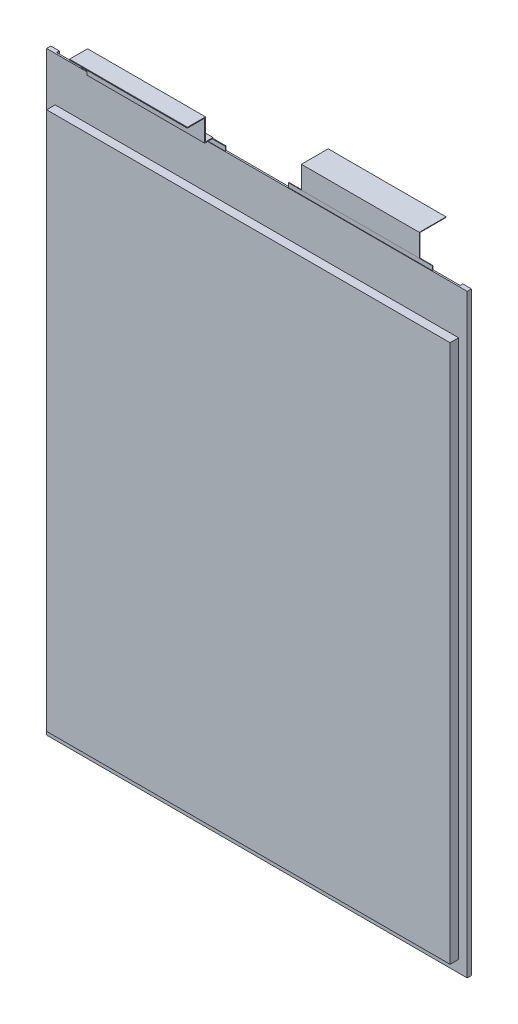
from build123d import *

# Parameters (mm, degrees)
INSULATION_DEPTH             = 0.3
INSULATION_DEPTH_BACK        = 0.3
SKETCH1_W                    = 160.6
SKETCH1_H                    = 227
MAIN_BODY_DEPTH              = 3.55
MAIN_BODY_DEPTH_BACK         = 3.55
SKETCH2_W                    = 154
SKETCH2_H                    = 205.5
SIDE_FOLDS_DEPTH             = 1.016
NEGATIVE_TAB_BASE_DEPTH      = 0.1
NEGATIVE_TAB_BASE_DEPTH_BACK = 0.1
SKETCH6_W                    = 55
SKETCH6_H                    = 18.6
POSITIVE_TAB_BASE_DEPTH      = 0.15
POSITIVE_TAB_BASE_DEPTH_BACK = 0.15
SKETCH7_W                    = 55
SKETCH7_H                    = 18.6
SKETCH110_W                  = 0.3
SKETCH110_H                  = 45
POSITIVE_TAB_DEPTH           = 23.650499994
SKETCH110_ON_SEGMENT_2_W     = 0.3
SKETCH110_ON_SEGMENT_2_H     = 45
POSITIVE_TAB_2_DEPTH         = 49.874449989
SKETCH110_ON_SEGMENT_3_W     = 0.3
SKETCH110_ON_SEGMENT_3_H     = 45
POSITIVE_TAB_3_DEPTH         = 55.260999989
SKETCH110_ON_SEGMENT_4_W     = 0.3
SKETCH110_ON_SEGMENT_4_H     = 45
POSITIVE_TAB_4_DEPTH         = 31.133774994
SKETCH110_ON_SEGMENT_5_W     = 0.3
SKETCH110_ON_SEGMENT_5_H     = 45
POSITIVE_TAB_5_DEPTH         = 1.15
SKETCH113_W                  = 0.2
SKETCH113_H                  = 45
NEGATIVE_TAB_DEPTH           = 31.960222221
SKETCH113_ON_SEGMENT_2_W     = 0.2
SKETCH113_ON_SEGMENT_2_H     = 45
NEGATIVE_TAB_2_DEPTH         = 33.621222221


with BuildPart() as part:
    # Sketch1 → Insulation (new, two sides: drawn at the far end of the back side and taken through both)
    with BuildSketch(Plane.XY.offset(-INSULATION_DEPTH_BACK)):
        Rectangle(SKETCH1_W, SKETCH1_H)
    extrude(amount=INSULATION_DEPTH + INSULATION_DEPTH_BACK)

    # Sketch2 → Main Body (add, two sides: drawn at the far end of the back side and taken through both)
    with BuildSketch(Plane.XY.offset(-MAIN_BODY_DEPTH_BACK)):
        with Locations((0, -6.25)):
            Rectangle(SKETCH2_W, SKETCH2_H)
    extrude(amount=MAIN_BODY_DEPTH + MAIN_BODY_DEPTH_BACK)

    # Sketch5 → Side Folds (add)
    with BuildSketch(Plane(origin=(0, 0, -0.3), x_dir=(-1, 0, 0), z_dir=(0, 0, -1))):
        Polygon((-77, -109), (-77, 96.5), (-77, 113.5), (-80.3, 113.5), (-80.3, -113.5), (-77, -113.5), align=None)
        Polygon((77, 113.5), (77, 96.5), (77, -109), (77, -113.5), (80.3, -113.5), (80.3, 113.5), align=None)
    extrude(amount=SIDE_FOLDS_DEPTH)

    # Sketch6 → Negative Tab Base (add, two sides: drawn at the far end of the back side and taken through both)
    with BuildSketch(Plane.XY.offset(-NEGATIVE_TAB_BASE_DEPTH_BACK)):
        with Locations((39.3, 105.8)):
            Rectangle(SKETCH6_W, SKETCH6_H)
    extrude(amount=NEGATIVE_TAB_BASE_DEPTH + NEGATIVE_TAB_BASE_DEPTH_BACK)

    # Sketch7 → Positive Tab Base (add, two sides: drawn at the far end of the back side and taken through both)
    with BuildSketch(Plane.XY.offset(-POSITIVE_TAB_BASE_DEPTH_BACK)):
        with Locations((-39.7, 105.8)):
            Rectangle(SKETCH7_W, SKETCH7_H)
    extrude(amount=POSITIVE_TAB_BASE_DEPTH + POSITIVE_TAB_BASE_DEPTH_BACK)


with BuildPart() as body_2:
    # Sketch110 → Positive Tab (new body)
    with BuildSketch(Plane(origin=(-39.7, 115.1, 0), x_dir=(0, 0, -1), z_dir=(0, 1, 0))):
        Rectangle(SKETCH110_W, SKETCH110_H)
    extrude(amount=POSITIVE_TAB_DEPTH)

    # Positive Tab mitre 1
    split(bisect_by=Plane(origin=(-39.7, 115.25, 0), x_dir=(1, 0, 0), z_dir=(0, -0.707106781, -0.707106781)), keep=Keep.TOP)


with BuildPart() as body_3:
    # Sketch110 on segment 2 (carried to segment 2) → Positive Tab 2 (new body)
    with BuildSketch(Plane(origin=(-39.7, 115.25, -23.500499994), x_dir=(0, 1, 0), z_dir=(0, 0, 1))):
        Rectangle(SKETCH110_ON_SEGMENT_2_W, SKETCH110_ON_SEGMENT_2_H)
    extrude(amount=POSITIVE_TAB_2_DEPTH)

    # Positive Tab 2 mitre 1
    split(bisect_by=Plane(origin=(-39.7, 115.25, 0), x_dir=(-1, 0, 0), z_dir=(0, 0.707106781, 0.707106781)), keep=Keep.TOP)

    # Positive Tab 2 mitre 2
    split(bisect_by=Plane(origin=(-39.7, 115.25, 2.87345), x_dir=(1, 0, 0), z_dir=(0, -0.707106781, -0.707106781)), keep=Keep.TOP)


with BuildPart() as body_4:
    # Sketch110 on segment 3 (carried to segment 3) → Positive Tab 3 (new body)
    with BuildSketch(Plane(origin=(-39.7, 91.749500006, 2.87345), x_dir=(0, 0, -1), z_dir=(0, 1, 0))):
        Rectangle(SKETCH110_ON_SEGMENT_3_W, SKETCH110_ON_SEGMENT_3_H)
    extrude(amount=POSITIVE_TAB_3_DEPTH)

    # Positive Tab 3 mitre 1
    split(bisect_by=Plane(origin=(-39.7, 115.25, 2.87345), x_dir=(-1, 0, 0), z_dir=(0, 0.707106781, 0.707106781)), keep=Keep.TOP)

    # Positive Tab 3 mitre 2
    split(bisect_by=Plane(origin=(-39.7, 123.51, 2.87345), x_dir=(1, 0, 0), z_dir=(0, -0.707106781, -0.707106781)), keep=Keep.TOP)


with BuildPart() as body_5:
    # Sketch110 on segment 4 (carried to segment 4) → Positive Tab 4 (new body)
    with BuildSketch(Plane(origin=(-39.7, 123.51, -20.627049994), x_dir=(0, 1, 0), z_dir=(0, 0, 1))):
        Rectangle(SKETCH110_ON_SEGMENT_4_W, SKETCH110_ON_SEGMENT_4_H)
    extrude(amount=POSITIVE_TAB_4_DEPTH)

    # Positive Tab 4 mitre 1
    split(bisect_by=Plane(origin=(-39.7, 123.51, 2.87345), x_dir=(-1, 0, 0), z_dir=(0, 0.707106781, 0.707106781)), keep=Keep.TOP)

    # Positive Tab 4 mitre 2
    split(bisect_by=Plane(origin=(-39.7, 123.51, 9.506725), x_dir=(0, 1, 0), z_dir=(0, 0, -1)), keep=Keep.TOP)


with BuildPart() as body_6:
    # Sketch110 on segment 5 (carried to segment 5) → Positive Tab 5 (new body)
    with BuildSketch(Plane(origin=(-39.7, 123.51, 8.506725), x_dir=(0, 1, 0), z_dir=(0, 0, 1))):
        Rectangle(SKETCH110_ON_SEGMENT_5_W, SKETCH110_ON_SEGMENT_5_H)
    extrude(amount=POSITIVE_TAB_5_DEPTH)

    # Positive Tab 5 mitre 1
    split(bisect_by=Plane(origin=(-39.7, 123.51, 9.506725), x_dir=(0, -1, 0), z_dir=(0, 0, 1)), keep=Keep.TOP)


with BuildPart() as body_7:
    # Sketch113 → Negative Tab (new body)
    with BuildSketch(Plane(origin=(39.3, 115.1, 0), x_dir=(0, 0, -1), z_dir=(0, 1, 0))):
        Rectangle(SKETCH113_W, SKETCH113_H)
    extrude(amount=NEGATIVE_TAB_DEPTH)

    # Negative Tab mitre 1
    split(bisect_by=Plane(origin=(39.3, 123.56, 0), x_dir=(1, 0, 0), z_dir=(0, -0.707106781, 0.707106781)), keep=Keep.TOP)


with BuildPart() as body_8:
    # Sketch113 on segment 2 (carried to segment 2) → Negative Tab 2 (new body)
    with BuildSketch(Plane(origin=(39.3, 123.56, 23.500222221), x_dir=(0, -1, 0), z_dir=(0, 0, -1))):
        Rectangle(SKETCH113_ON_SEGMENT_2_W, SKETCH113_ON_SEGMENT_2_H)
    extrude(amount=NEGATIVE_TAB_2_DEPTH)

    # Negative Tab 2 mitre 1
    split(bisect_by=Plane(origin=(39.3, 123.56, 0), x_dir=(-1, 0, 0), z_dir=(0, 0.707106781, -0.707106781)), keep=Keep.TOP)


solid = Compound([part.part, body_2.part, body_3.part, body_4.part, body_5.part, body_6.part, body_7.part, body_8.part])
